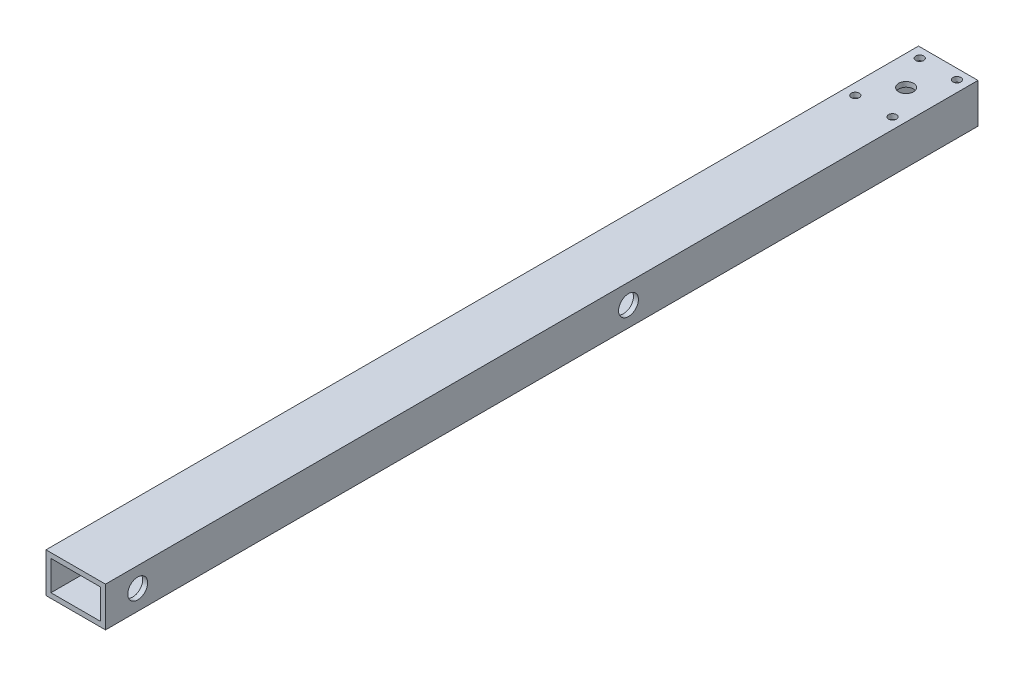
from build123d import *

# Parameters (mm, degrees)
SKETCH1_W           = 38.1
SKETCH1_H           = 25.4
SKETCH1_W_2         = 31.75
SKETCH1_H_2         = 19.05
BOSS_EXTRUDE1_DEPTH = 558.8
CUT_EXTRUDE1_REACH  = 561.701
SKETCH2_R           = 4.7625
SKETCH2_R_2         = 2.54
SKETCH3_R           = 3.175
CUT_EXTRUDE2_DEPTH  = 3.175
SKETCH4_R           = 6.35
CUT_EXTRUDE3_DEPTH  = 3.175


with BuildPart() as part:
    # Sketch1 → Boss-Extrude1 (new body)
    with BuildSketch(Plane.XY):
        Rectangle(SKETCH1_W, SKETCH1_H)
        Rectangle(SKETCH1_W_2, SKETCH1_H_2, mode=Mode.SUBTRACT)
    extrude(amount=BOSS_EXTRUDE1_DEPTH)

    # Cut-Extrude1: up to this face of the body (flat: up to its plane)
    cut_extrude1_end = Plane(part.part.faces().sort_by_distance((0, -12.7, 279.4))[0])
    # Sketch2 → Cut-Extrude1 (cut, up to the picked face)
    with BuildSketch(Plane(origin=(0, 12.7, 0), x_dir=(1, 0, 0), z_dir=(0, 1, 0)), mode=Mode.PRIVATE) as cut_extrude1_sk1:
        with Locations(Location((0, -26.9875, 0), (0, 0, 270))):
            Circle(SKETCH2_R)
    cut_extrude1_tool1 = split(extrude(cut_extrude1_sk1.sketch, amount=-CUT_EXTRUDE1_REACH, mode=Mode.PRIVATE), bisect_by=cut_extrude1_end, keep=Keep.BOTH, mode=Mode.PRIVATE)
    # Sketch2 → Cut-Extrude1 (cut, up to the picked face)
    with BuildSketch(Plane(origin=(0, 12.7, 0), x_dir=(1, 0, 0), z_dir=(0, 1, 0)), mode=Mode.PRIVATE) as cut_extrude1_sk2:
        with Locations(Location((11.90625, -47.609729928, 0), (0, 0, 270))):
            Circle(SKETCH2_R_2)
    cut_extrude1_tool2 = split(extrude(cut_extrude1_sk2.sketch, amount=-CUT_EXTRUDE1_REACH, mode=Mode.PRIVATE), bisect_by=cut_extrude1_end, keep=Keep.BOTH, mode=Mode.PRIVATE)
    # Sketch2 → Cut-Extrude1 (cut, up to the picked face)
    with BuildSketch(Plane(origin=(0, 12.7, 0), x_dir=(1, 0, 0), z_dir=(0, 1, 0)), mode=Mode.PRIVATE) as cut_extrude1_sk3:
        with Locations(Location((-11.90625, -47.609729928, 0), (0, 0, 270))):
            Circle(SKETCH2_R_2)
    cut_extrude1_tool3 = split(extrude(cut_extrude1_sk3.sketch, amount=-CUT_EXTRUDE1_REACH, mode=Mode.PRIVATE), bisect_by=cut_extrude1_end, keep=Keep.BOTH, mode=Mode.PRIVATE)
    # Sketch2 → Cut-Extrude1 (cut, up to the picked face)
    with BuildSketch(Plane(origin=(0, 12.7, 0), x_dir=(1, 0, 0), z_dir=(0, 1, 0)), mode=Mode.PRIVATE) as cut_extrude1_sk4:
        with Locations(Location((-11.90625, -6.365270072, 0), (0, 0, 270))):
            Circle(SKETCH2_R_2)
    cut_extrude1_tool4 = split(extrude(cut_extrude1_sk4.sketch, amount=-CUT_EXTRUDE1_REACH, mode=Mode.PRIVATE), bisect_by=cut_extrude1_end, keep=Keep.BOTH, mode=Mode.PRIVATE)
    # Sketch2 → Cut-Extrude1 (cut, up to the picked face)
    with BuildSketch(Plane(origin=(0, 12.7, 0), x_dir=(1, 0, 0), z_dir=(0, 1, 0)), mode=Mode.PRIVATE) as cut_extrude1_sk5:
        with Locations(Location((11.90625, -6.365270072, 0), (0, 0, 270))):
            Circle(SKETCH2_R_2)
    cut_extrude1_tool5 = split(extrude(cut_extrude1_sk5.sketch, amount=-CUT_EXTRUDE1_REACH, mode=Mode.PRIVATE), bisect_by=cut_extrude1_end, keep=Keep.BOTH, mode=Mode.PRIVATE)
    add(cut_extrude1_tool1.solids().sort_by(Axis((0, 12.7, 26.9875), (0, -1, 0)))[0], mode=Mode.SUBTRACT)
    add(cut_extrude1_tool2.solids().sort_by(Axis((11.90625, 12.7, 47.60973), (0, -1, 0)))[0], mode=Mode.SUBTRACT)
    add(cut_extrude1_tool3.solids().sort_by(Axis((-11.90625, 12.7, 47.60973), (0, -1, 0)))[0], mode=Mode.SUBTRACT)
    add(cut_extrude1_tool4.solids().sort_by(Axis((-11.90625, 12.7, 6.36527), (0, -1, 0)))[0], mode=Mode.SUBTRACT)
    add(cut_extrude1_tool5.solids().sort_by(Axis((11.90625, 12.7, 6.36527), (0, -1, 0)))[0], mode=Mode.SUBTRACT)

    # Sketch3 → Cut-Extrude2 (cut)
    with BuildSketch(Plane.ZY.offset(19.05)):
        with Locations((538.1625, 0)):
            Circle(SKETCH3_R)
        with Locations((223.8375, 0)):
            Circle(SKETCH3_R)
    extrude(amount=-CUT_EXTRUDE2_DEPTH, mode=Mode.SUBTRACT)

    # Sketch4 → Cut-Extrude3 (cut)
    with BuildSketch(Plane(origin=(19.05, 0, 0), x_dir=(0, 0, -1), z_dir=(1, 0, 0))):
        with Locations((-223.8375, 0)):
            Circle(SKETCH4_R)
        with Locations((-538.1625, 0)):
            Circle(SKETCH4_R)
    extrude(amount=-CUT_EXTRUDE3_DEPTH, mode=Mode.SUBTRACT)


solid = part.part
